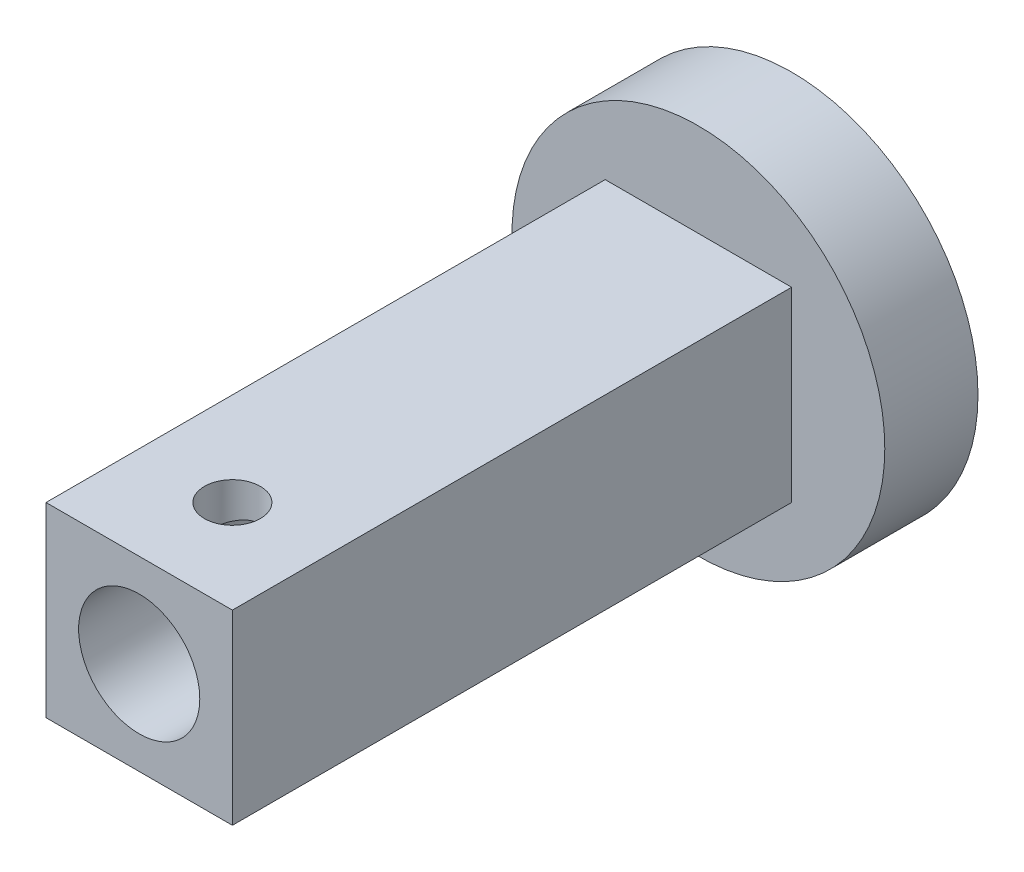
from build123d import *

# Parameters (mm, degrees)
SKETCH_1_R          = 10
SKETCH_1_R_2        = 3.25
EXTRUDE_1_DEPTH     = 5
SKETCH_2_W          = 10
SKETCH_2_H          = 10
EXTRUDE_4_DEPTH     = 30
CUT_EXTRUDE_START   = -30
SKETCH_6_R          = 3.25
CUT_EXTRUDE_1_DEPTH = 30
SKETCH_7_R          = 1.5
CUT_EXTRUDE_3_DEPTH = 5


with BuildPart() as part:
    # Эскиз1 → Бобышка-Вытянуть1 (new body)
    with BuildSketch(Plane.XY):
        Circle(SKETCH_1_R)
        Circle(SKETCH_1_R_2, mode=Mode.SUBTRACT)
    extrude(amount=EXTRUDE_1_DEPTH)

    # Эскиз2 → Бобышка-Вытянуть4 (add)
    with BuildSketch(Plane.XY.offset(5)):
        Rectangle(SKETCH_2_W, SKETCH_2_H)
    extrude(amount=EXTRUDE_4_DEPTH)

    # Эскиз6 → Вырез-Вытянуть1 (cut)
    with BuildSketch(Plane.XY.offset(35).offset(CUT_EXTRUDE_START)):
        Circle(SKETCH_6_R)
    extrude(amount=CUT_EXTRUDE_1_DEPTH, mode=Mode.SUBTRACT)

    # Эскиз7 → Вырез-Вытянуть3 (cut)
    with BuildSketch(Plane(origin=(0, 5, 0), x_dir=(1, 0, 0), z_dir=(0, 1, 0))):
        with Locations(Location((0, -30, 0), (0, 0, 270))):
            Circle(SKETCH_7_R)
    extrude(amount=-CUT_EXTRUDE_3_DEPTH, mode=Mode.SUBTRACT)


solid = part.part
